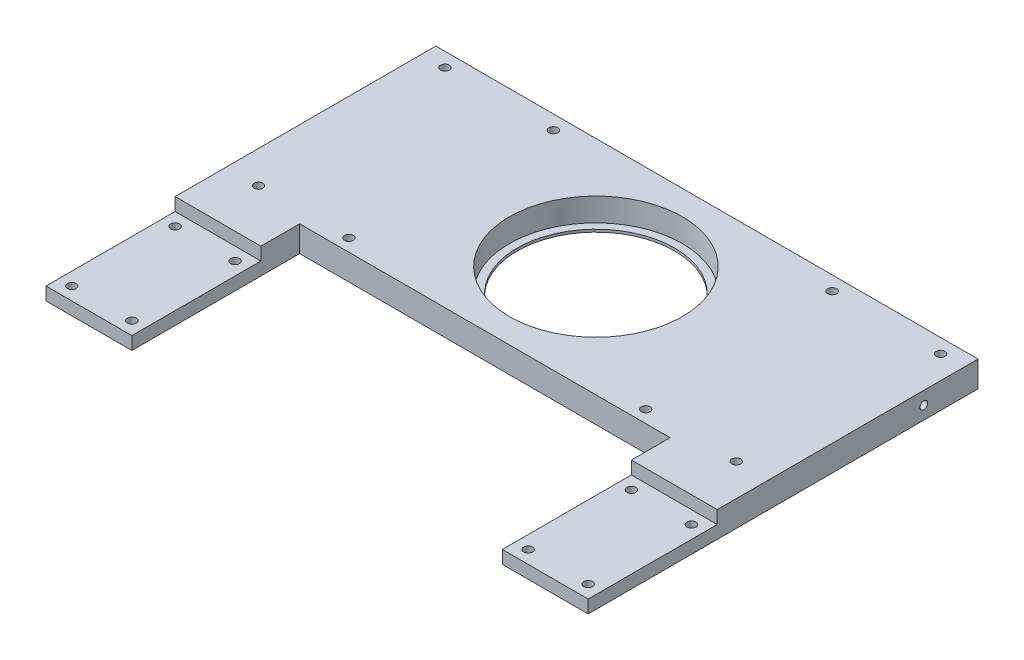
from build123d import *

# Parameters (mm, degrees)
SKIZZE1_W                        = 210
SKIZZE1_H                        = 400
AUFSATZ_LINEAR_AUSTRAGEN1_DEPTH  = 10
SKIZZE5_W                        = 210
SKIZZE5_H                        = 95
SCHNITT_LINEAR_AUSTRAGEN2_DEPTH  = 10
SKIZZE6_R                        = 1.7
SCHNITT_LINEAR_AUSTRAGEN3_DEPTH  = 227.108381092
SCHNITT_LINEAR_AUSTRAGEN4_DEPTH  = 4
SKIZZE16_W                       = 35
SKIZZE16_H                       = 7
SCHNITT_LINEAR_AUSTRAGEN10_DEPTH = 5
SCHNITT_LINEAR_AUSTRAGEN11_DEPTH = 35
SKIZZE20_R                       = 1.7
SCHNITT_LINEAR_AUSTRAGEN12_DEPTH = 227.108381092
SKIZZE21_W                       = 143.493506494
SKIZZE21_H                       = 65
SCHNITT_LINEAR_AUSTRAGEN13_DEPTH = 227.108381092
SCHNITT_LINEAR_AUSTRAGEN14_DEPTH = 227.108381092
AUFSATZ_LINEAR_AUSTRAGEN6_DEPTH  = 10
SKIZZE25_R                       = 1.7
SCHNITT_LINEAR_AUSTRAGEN15_DEPTH = 227.108381092
SCHNITT_LINEAR_AUSTRAGEN16_DEPTH = 291.172362571
SKIZZE27_R                       = 33.5
SCHNITT_LINEAR_AUSTRAGEN17_DEPTH = 149.828760661
SKIZZE28_R                       = 36.006256149
SKIZZE28_R_2                     = 30.5
AUFSATZ_LINEAR_AUSTRAGEN7_DEPTH  = 1
SKIZZE29_R                       = 1.5
SCHNITT_LINEAR_AUSTRAGEN18_DEPTH = 10
SKIZZE30_R                       = 1.5
SCHNITT_LINEAR_AUSTRAGEN19_DEPTH = 10
SKIZZE31_R                       = 2.95
SCHNITT_LINEAR_AUSTRAGEN20_DEPTH = 3.5


with BuildPart() as part:
    # Skizze1 → Aufsatz-Linear austragen1 (new body)
    with BuildSketch(Plane(origin=(0, 0, 0), x_dir=(1, 0, 0), z_dir=(0, 1, 0))):
        Rectangle(SKIZZE1_W, SKIZZE1_H)
    extrude(amount=AUFSATZ_LINEAR_AUSTRAGEN1_DEPTH)

    # Skizze5 → Schnitt-Linear austragen2 (cut)
    with BuildSketch(Plane(origin=(0, 10, 0), x_dir=(1, 0, 0), z_dir=(0, 1, 0))):
        Polygon((105, -200), (18, -200), (105, -46), align=None)
        Polygon((-18, -200), (-105, -46), (-105, -200), align=None)
        with Locations((0, 152.5)):
            Rectangle(SKIZZE5_W, SKIZZE5_H)
        Polygon((71.746753247, -46), (-71.746753247, -46), (-2.824675325, -168), (2.824675325, -168), align=None)
    extrude(amount=-SCHNITT_LINEAR_AUSTRAGEN2_DEPTH, mode=Mode.SUBTRACT)

    # Skizze6 → Schnitt-Linear austragen3 (cut, through all)
    with BuildSketch(Plane(origin=(0, 10, 0), x_dir=(1, 0, 0), z_dir=(0, 1, 0))):
        with Locations(Location((-11, -195, 0), (0, 0, 270))):
            Circle(SKIZZE6_R)
        with Locations(Location((-11, -178.18, 0), (0, 0, 90))):
            Circle(SKIZZE6_R)
        with Locations(Location((11, -195, 0), (0, 0, 90))):
            Circle(SKIZZE6_R)
        with Locations(Location((11, -178.18, 0), (0, 0, 270))):
            Circle(SKIZZE6_R)
    extrude(amount=-SCHNITT_LINEAR_AUSTRAGEN3_DEPTH, mode=Mode.SUBTRACT)

    # Skizze7 → Schnitt-Linear austragen4 (cut)
    with BuildSketch(Plane.XZ):
        Polygon((-11, 198.406366588), (-8.05, 196.703183294), (-8.05, 193.296816706), (-11, 191.593633412), (-13.95, 193.296816706), (-13.95, 196.703183294), align=None)
        Polygon((11, 198.406366588), (8.05, 196.703183294), (8.05, 193.296816706), (11, 191.593633412), (13.95, 193.296816706), (13.95, 196.703183294), align=None)
        Polygon((-8.05, 176.476816706), (-8.05, 179.883183294), (-11, 181.586366588), (-13.95, 179.883183294), (-13.95, 176.476816706), (-11, 174.773633412), align=None)
        Polygon((8.05, 176.476816706), (8.05, 179.883183294), (11, 181.586366588), (13.95, 179.883183294), (13.95, 176.476816706), (11, 174.773633412), align=None)
    extrude(amount=-SCHNITT_LINEAR_AUSTRAGEN4_DEPTH, mode=Mode.SUBTRACT)

    # Skizze16 → Schnitt-Linear austragen10 (cut)
    with BuildSketch(Plane.XZ):
        with Locations((0, 186.59)):
            Rectangle(SKIZZE16_W, SKIZZE16_H)
    extrude(amount=-SCHNITT_LINEAR_AUSTRAGEN10_DEPTH, mode=Mode.SUBTRACT)

    # Skizze17 → Schnitt-Linear austragen11 (cut)
    with BuildSketch(Plane.ZY.offset(-17.5)):
        Polygon((183.09, 5), (186.59, 8.5), (190.09, 5), align=None)
    extrude(amount=SCHNITT_LINEAR_AUSTRAGEN11_DEPTH, mode=Mode.SUBTRACT)

    # Skizze20 → Schnitt-Linear austragen12 (cut, through all)
    with BuildSketch(Plane(origin=(0, 10, 0), x_dir=(1, 0, 0), z_dir=(0, 1, 0))):
        with Locations(Location((96, 99.52, 0), (0, 0, 270))):
            Circle(SKIZZE20_R)
        with Locations(Location((54, 99.52, 0), (0, 0, 270))):
            Circle(SKIZZE20_R)
        with Locations(Location((-54, 99.52, 0), (0, 0, 90))):
            Circle(SKIZZE20_R)
        with Locations(Location((-96, 99.52, 0), (0, 0, 90))):
            Circle(SKIZZE20_R)
        with Locations(Location((92.5, 23.82, 0), (0, 0, 270))):
            Circle(SKIZZE20_R)
        with Locations(Location((57.5, 23.82, 0), (0, 0, 270))):
            Circle(SKIZZE20_R)
        with Locations(Location((-92.5, 23.82, 0), (0, 0, 90))):
            Circle(SKIZZE20_R)
        with Locations(Location((-57.5, 23.82, 0), (0, 0, 90))):
            Circle(SKIZZE20_R)
    extrude(amount=-SCHNITT_LINEAR_AUSTRAGEN12_DEPTH, mode=Mode.SUBTRACT)

    # Skizze21 → Schnitt-Linear austragen13 (cut, through all)
    with BuildSketch(Plane(origin=(0, 10, 0), x_dir=(1, 0, 0), z_dir=(0, 1, 0))):
        with Locations((0, -13.5)):
            Rectangle(SKIZZE21_W, SKIZZE21_H)
    extrude(amount=-SCHNITT_LINEAR_AUSTRAGEN13_DEPTH, mode=Mode.SUBTRACT)

    # Skizze22 → Schnitt-Linear austragen14 (cut, through all)
    with BuildSketch(Plane(origin=(0, 10, 0), x_dir=(1, 0, 0), z_dir=(0, 1, 0))):
        with BuildLine():
            Line((-71.746753247, -46), (-2.824675325, -168))
            ThreePointArc((-2.824675325, -168), (-55.506711033, -117.293679981), (-71.746753247, -46))
        make_face()
    schnitt_linear_austragen14 = extrude(amount=-SCHNITT_LINEAR_AUSTRAGEN14_DEPTH, mode=Mode.SUBTRACT)

    # Skizze23 → Aufsatz-Linear austragen6 (add)
    with BuildSketch(Plane(origin=(0, 10, 0), x_dir=(1, 0, 0), z_dir=(0, 1, 0))):
        with BuildLine():
            Line((-105, -46), (-18, -200))
            ThreePointArc((-18, -200), (-78.088357737, -132.371344955), (-105, -46))
        make_face()
    aufsatz_linear_austragen6 = extrude(amount=-AUFSATZ_LINEAR_AUSTRAGEN6_DEPTH)

    # Spiegeln2: Schnitt-Linear austragen14, Aufsatz-Linear austragen6 across plane
    add(schnitt_linear_austragen14.mirror(Plane(origin=(0, 0, 0), x_dir=(0, 0, 1), z_dir=(1, 0, 0))), mode=Mode.SUBTRACT)
    add(aufsatz_linear_austragen6.mirror(Plane(origin=(0, 0, 0), x_dir=(0, 0, 1), z_dir=(1, 0, 0))))

    # Skizze25 → Schnitt-Linear austragen15 (cut, through all)
    with BuildSketch(Plane(origin=(0, 10, 0), x_dir=(1, 0, 0), z_dir=(0, 1, 0))):
        with Locations(Location((-100, -1, 0), (0, 0, 270))):
            Circle(SKIZZE25_R)
        with Locations(Location((-76.746753247, -1, 0), (0, 0, 90))):
            Circle(SKIZZE25_R)
        with Locations(Location((-76.746753247, -41, 0), (0, 0, 270))):
            Circle(SKIZZE25_R)
        with Locations(Location((-100, -41, 0), (0, 0, 90))):
            Circle(SKIZZE25_R)
    schnitt_linear_austragen15 = extrude(amount=-SCHNITT_LINEAR_AUSTRAGEN15_DEPTH, mode=Mode.SUBTRACT)

    # Spiegeln3: Schnitt-Linear austragen15 across plane
    add(schnitt_linear_austragen15.mirror(Plane(origin=(0, 0, 0), x_dir=(0, 0, 1), z_dir=(1, 0, 0))), mode=Mode.SUBTRACT)

    # Skizze26 → Schnitt-Linear austragen16 (cut, through all)
    with BuildSketch(Plane.ZY.offset(105)):
        Polygon((-4, 5), (-4, 13.101486595), (200.684563047, 82.546277137), (242.997216492, -41.037631402), (91.241487897, -60.284782055), (46, 0), (46, 5), align=None)
    extrude(amount=-SCHNITT_LINEAR_AUSTRAGEN16_DEPTH, mode=Mode.SUBTRACT)

    # Skizze27 → Schnitt-Linear austragen17 (cut, through all)
    with BuildSketch(Plane(origin=(0, 10, 0), x_dir=(1, 0, 0), z_dir=(0, 1, 0))):
        with Locations(Location((0, 62, 0), (0, 0, 270))):
            Circle(SKIZZE27_R)
    extrude(amount=-SCHNITT_LINEAR_AUSTRAGEN17_DEPTH, mode=Mode.SUBTRACT)

    # Skizze28 → Aufsatz-Linear austragen7 (add)
    with BuildSketch(Plane.XZ):
        with Locations((0, -62)):
            Circle(SKIZZE28_R)
        with Locations(Location((0, -62, 0), (0, 0, 270))):
            Circle(SKIZZE28_R_2, mode=Mode.SUBTRACT)
    extrude(amount=-AUFSATZ_LINEAR_AUSTRAGEN7_DEPTH)

    # Skizze29 → Schnitt-Linear austragen18 (cut)
    with BuildSketch(Plane.ZY.offset(105)):
        with Locations((-84, 5)):
            Circle(SKIZZE29_R)
    schnitt_linear_austragen18 = extrude(amount=-SCHNITT_LINEAR_AUSTRAGEN18_DEPTH, mode=Mode.SUBTRACT)

    # Skizze30 → Schnitt-Linear austragen19 (cut)
    with BuildSketch(Plane(origin=(0, 0, -105), x_dir=(-1, 0, 0), z_dir=(0, 0, -1))):
        with Locations((100, 5)):
            Circle(SKIZZE30_R)
        with Locations((84, 5)):
            Circle(SKIZZE30_R)
    schnitt_linear_austragen19 = extrude(amount=-SCHNITT_LINEAR_AUSTRAGEN19_DEPTH, mode=Mode.SUBTRACT)

    # Spiegeln4: Schnitt-Linear austragen18, Schnitt-Linear austragen19 across plane
    add(schnitt_linear_austragen18.mirror(Plane(origin=(0, 0, 0), x_dir=(0, 0, 1), z_dir=(1, 0, 0))), mode=Mode.SUBTRACT)
    add(schnitt_linear_austragen19.mirror(Plane(origin=(0, 0, 0), x_dir=(0, 0, 1), z_dir=(1, 0, 0))), mode=Mode.SUBTRACT)

    # Skizze31 → Schnitt-Linear austragen20 (cut)
    with BuildSketch(Plane.XZ):
        with Locations(Location((-96, -99.52, 0), (0, 0, 270))):
            Circle(SKIZZE31_R)
        with Locations(Location((-54, -99.52, 0), (0, 0, 270))):
            Circle(SKIZZE31_R)
        with Locations(Location((-92.5, -23.82, 0), (0, 0, 270))):
            Circle(SKIZZE31_R)
        with Locations(Location((-57.5, -23.82, 0), (0, 0, 270))):
            Circle(SKIZZE31_R)
        with Locations(Location((57.5, -23.82, 0), (0, 0, 90))):
            Circle(SKIZZE31_R)
        with Locations(Location((92.5, -23.82, 0), (0, 0, 90))):
            Circle(SKIZZE31_R)
        with Locations(Location((54, -99.52, 0), (0, 0, 90))):
            Circle(SKIZZE31_R)
        with Locations(Location((96, -99.52, 0), (0, 0, 90))):
            Circle(SKIZZE31_R)
    extrude(amount=-SCHNITT_LINEAR_AUSTRAGEN20_DEPTH, mode=Mode.SUBTRACT)


solid = part.part
